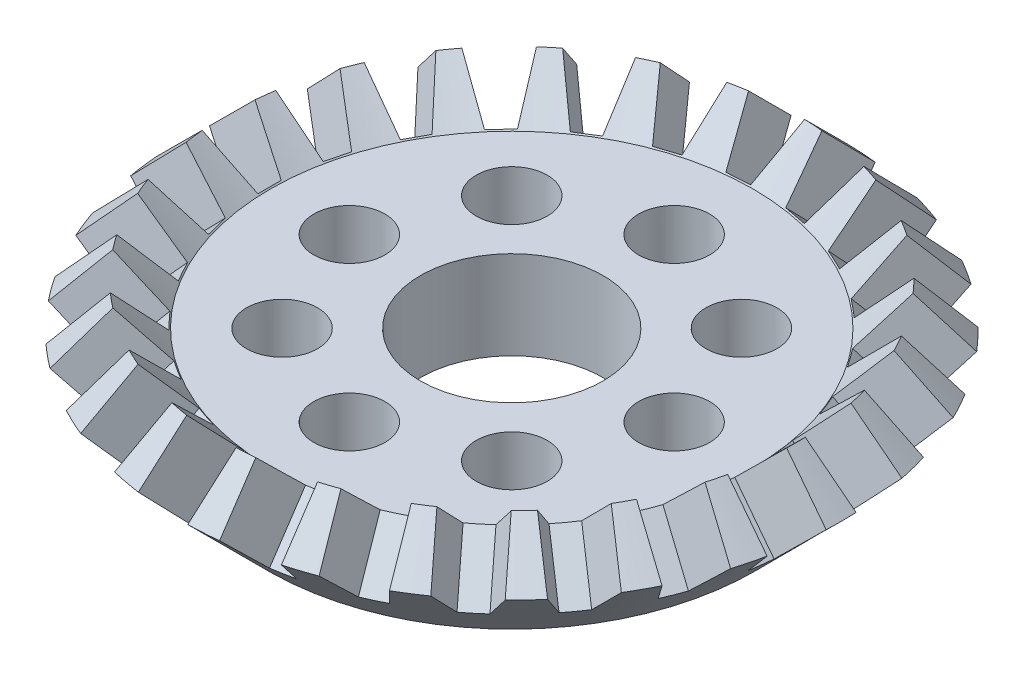
from build123d import *

# Parameters (mm, degrees)
CUT_EXTRUDE11_DEPTH = 10
SKETCH5_R           = 4.5
CUT_EXTRUDE12_DEPTH = 10
SKETCH5_3_R         = 1.75
CUT_EXTRUDE13_DEPTH = 10
CIRPATTERN13_COUNT  = 8
CIRPATTERN14_COUNT  = 25


with BuildPart() as part:
    # Sketch2 → Revolve4 (revolve)
    with BuildSketch(Plane.XY, mode=Mode.PRIVATE) as revolve4_sk:
        Polygon((0, 0), (0, 4.355813863), (-11.886826824, 4.355813863), (-14.008147168, 6.477134207), (-16.242640687, 4.242640687), (-12, 0), align=None)
    revolve(revolve4_sk.sketch.rotate(Axis((0, 0, 0), (0, 1, 0)), 270), axis=Axis((0, 0, 0), (0, 1, 0)))

    # Sketch4 → Cut-Extrude11 (cut)
    with BuildSketch(Plane(origin=(-6, -6, 0), x_dir=(0, 0, 1), z_dir=(-0.7071067811865476, -0.7071067811865475, 0))):
        Polygon((-0.575906499, 11.556444953), (0.575906499, 11.556444953), (1.411909827, 14.888208465), (-1.411909827, 14.888208465), align=None)
    cut_extrude11 = extrude(amount=-CUT_EXTRUDE11_DEPTH, mode=Mode.SUBTRACT)

    # Sketch5 → Cut-Extrude12 (cut)
    with BuildSketch(Plane(origin=(0, 4.355813863, 0), x_dir=(1, 0, 0), z_dir=(0, 1, 0))):
        with Locations(Location((0, 0, 0), (0, 0, 270))):
            Circle(SKETCH5_R)
    extrude(amount=-CUT_EXTRUDE12_DEPTH, mode=Mode.SUBTRACT)

    # Sketch5<3> → Cut-Extrude13 (cut)
    with BuildSketch(Plane(origin=(0, 4.355813863, 0), x_dir=(1, 0, 0), z_dir=(0, 1, 0))):
        with Locations(Location((0, -8, 0), (0, 0, 270))):
            Circle(SKETCH5_3_R)
    cut_extrude13 = extrude(amount=-CUT_EXTRUDE13_DEPTH, mode=Mode.SUBTRACT)

    # CirPattern13: Cut-Extrude13 ×8 about axis
    cirpattern13_axis = Axis((0, 0, 0), (0, 1, 0))
    for i in range(1, CIRPATTERN13_COUNT):
        add(cut_extrude13.rotate(cirpattern13_axis, i * 360 / CIRPATTERN13_COUNT), mode=Mode.SUBTRACT)

    # CirPattern14: Cut-Extrude11 ×25 about axis
    cirpattern14_axis = Axis((0, 0, 0), (0, 1, 0))
    for i in range(1, CIRPATTERN14_COUNT):
        add(cut_extrude11.rotate(cirpattern14_axis, i * 360 / CIRPATTERN14_COUNT), mode=Mode.SUBTRACT)


solid = part.part
